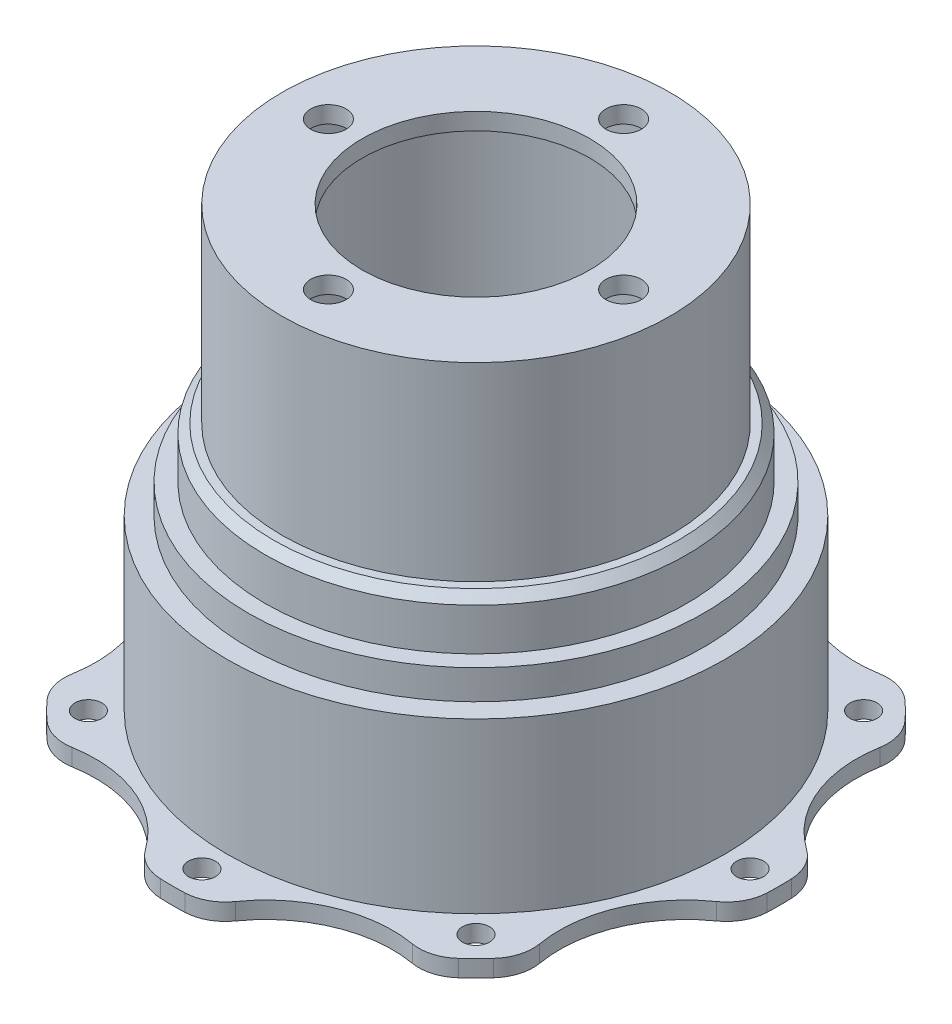
from build123d import *

# Parameters (mm, degrees)
SKETCH_1_R                       = 23
SKETCH_1_R_2                     = 13.5
EXTRUDE_1_DEPTH                  = 2
SKETCH_2_R                       = 2.1
CUT_EXTRUDE_1_DEPTH              = 3
PATTERN_CIRCULAR_1_COUNT         = 4
EXTRUDE_START                    = 32
SKETCH_3_R                       = 23
SKETCH_3_R_2                     = 21.25
EXTRUDE_2_DEPTH                  = 32
SKETCH_4_R                       = 29.5
SKETCH_4_R_2                     = 21.5
EXTRUDE_3_DEPTH                  = 2
EXTRUDE_START_2                  = 20
SKETCH_5_R                       = 29.5
SKETCH_5_R_2                     = 27.5
EXTRUDE_4_DEPTH                  = 20
SKETCH_6_R                       = 36
SKETCH_6_R_2                     = 29
EXTRUDE_5_DEPTH                  = 2
SKETCH_7_R                       = 1.6
CUT_EXTRUDE_2_DEPTH              = 3
PATTERN_CIRCULAR_2_COUNT         = 8
SKETCH_8_R                       = 25
SKETCH_8_R_2                     = 23
EXTRUDE_6_DEPTH                  = 9.5
SKETCH_9_R                       = 27
SKETCH_9_R_2                     = 25
EXTRUDE_7_DEPTH                  = 3.5
CHAMFER_1_SIZE                   = 1
SKETCH_12_R                      = 15
CUT_EXTRUDE_4_DEPTH              = 10
FILLET_2_R                       = 5
PATTERN_CIRCULAR_4_COUNT         = 8
FILLET_2_OF_PATTERN_CIRCULAR_4_R = 5


with BuildPart() as part:
    # 草图1 → 凸台-拉伸1 (new body)
    with BuildSketch(Plane(origin=(0, 0, 0), x_dir=(1, 0, 0), z_dir=(0, 1, 0))):
        with Locations(Location((0, 0, 0), (0, 0, 270))):
            Circle(SKETCH_1_R)
        with Locations(Location((0, 0, 0), (0, 0, 270))):
            Circle(SKETCH_1_R_2, mode=Mode.SUBTRACT)
    extrude(amount=EXTRUDE_1_DEPTH)

    # 草图2 → 切除-拉伸1 (cut)
    with BuildSketch(Plane(origin=(0, 2, 0), x_dir=(1, 0, 0), z_dir=(0, 1, 0))):
        with Locations(Location((0, 17.5, 0), (0, 0, 270))):
            Circle(SKETCH_2_R)
    cut_extrude_1 = extrude(amount=-CUT_EXTRUDE_1_DEPTH, mode=Mode.SUBTRACT)

    # 阵列(圆周)1: 切除-拉伸1 ×4 about axis
    pattern_circular_1_axis = Axis((0, 0, 0), (0, 1, 0))
    for i in range(1, PATTERN_CIRCULAR_1_COUNT):
        add(cut_extrude_1.rotate(pattern_circular_1_axis, i * 360 / PATTERN_CIRCULAR_1_COUNT), mode=Mode.SUBTRACT)

    # 草图3 → 凸台-拉伸2 (add)
    with BuildSketch(Plane.XZ.offset(EXTRUDE_START)):
        with Locations(Location((0, 0, 0), (0, 0, 270))):
            Circle(SKETCH_3_R)
        with Locations(Location((0, 0, 0), (0, 0, 270))):
            Circle(SKETCH_3_R_2, mode=Mode.SUBTRACT)
    extrude(amount=-EXTRUDE_2_DEPTH)

    # 草图4 → 凸台-拉伸3 (add)
    with BuildSketch(Plane.XZ.offset(32)):
        with Locations(Location((0, 0, 0), (0, 0, 270))):
            Circle(SKETCH_4_R)
        Circle(SKETCH_4_R_2, mode=Mode.SUBTRACT)
    extrude(amount=-EXTRUDE_3_DEPTH)

    # 草图5 → 凸台-拉伸4 (add)
    with BuildSketch(Plane.XZ.offset(32).offset(EXTRUDE_START_2)):
        with Locations(Location((0, 0, 0), (0, 0, 270))):
            Circle(SKETCH_5_R)
        with Locations(Location((0, 0, 0), (0, 0, 270))):
            Circle(SKETCH_5_R_2, mode=Mode.SUBTRACT)
    extrude(amount=-EXTRUDE_4_DEPTH)

    # 草图6 → 凸台-拉伸5 (add)
    with BuildSketch(Plane.XZ.offset(52)):
        with Locations(Location((0, 0, 0), (0, 0, 270))):
            Circle(SKETCH_6_R)
        Circle(SKETCH_6_R_2, mode=Mode.SUBTRACT)
    extrude(amount=-EXTRUDE_5_DEPTH)

    # 草图7 → 切除-拉伸2 (cut)
    with BuildSketch(Plane(origin=(0, -50, 0), x_dir=(1, 0, 0), z_dir=(0, 1, 0))):
        with Locations(Location((0, 32.5, 0), (0, 0, 270))):
            Circle(SKETCH_7_R)
    cut_extrude_2 = extrude(amount=-CUT_EXTRUDE_2_DEPTH, mode=Mode.SUBTRACT)

    # 阵列(圆周)2: 切除-拉伸2 ×8 about axis
    pattern_circular_2_axis = Axis((0, 0, 0), (0, 1, 0))
    for i in range(1, PATTERN_CIRCULAR_2_COUNT):
        add(cut_extrude_2.rotate(pattern_circular_2_axis, i * 360 / PATTERN_CIRCULAR_2_COUNT), mode=Mode.SUBTRACT)

    # 草图8 → 凸台-拉伸6 (add)
    with BuildSketch(Plane(origin=(0, -30, 0), x_dir=(1, 0, 0), z_dir=(0, 1, 0))):
        with Locations(Location((0, 0, 0), (0, 0, 90))):
            Circle(SKETCH_8_R)
        with Locations(Location((0, 0, 0), (0, 0, 270))):
            Circle(SKETCH_8_R_2, mode=Mode.SUBTRACT)
    extrude(amount=EXTRUDE_6_DEPTH)

    # 草图9 → 凸台-拉伸7 (add)
    with BuildSketch(Plane(origin=(0, -30, 0), x_dir=(1, 0, 0), z_dir=(0, 1, 0))):
        with Locations(Location((0, 0, 0), (0, 0, 90))):
            Circle(SKETCH_9_R)
        with Locations(Location((0, 0, 0), (0, 0, 270))):
            Circle(SKETCH_9_R_2, mode=Mode.SUBTRACT)
    extrude(amount=EXTRUDE_7_DEPTH)

    # 倒角1
    chamfer_1_edges = [part.edges().sort_by_distance(p)[0] for p in [
        (0, -20.5, 25),
    ]]
    chamfer(chamfer_1_edges, length=CHAMFER_1_SIZE)

    # 草图12 → 切除-拉伸4 (cut)
    with BuildSketch(Plane(origin=(0, -50, 0), x_dir=(1, 0, 0), z_dir=(0, 1, 0))):
        with Locations((17.603437889, 42.498458496)):
            Circle(SKETCH_12_R)
    cut_extrude_4 = extrude(amount=-CUT_EXTRUDE_4_DEPTH, mode=Mode.SUBTRACT)

    # 圆角2
    fillet_2_edges = [part.edges().sort_by_distance(p)[0] for p in [
        (22.307845583, -51, -28.255265446),
        (4.205460916, -51, -35.753518687),
    ]]
    fillet(fillet_2_edges, radius=FILLET_2_R)

    # 阵列(圆周)4: 切除-拉伸4 ×8 about axis
    pattern_circular_4_axis = Axis((0, 0, 0), (0, 1, 0))
    for i in range(1, PATTERN_CIRCULAR_4_COUNT):
        add(cut_extrude_4.rotate(pattern_circular_4_axis, i * 360 / PATTERN_CIRCULAR_4_COUNT), mode=Mode.SUBTRACT)

    # 圆角2 of 阵列(圆周)4
    fillet_2_of_pattern_circular_4_edges = [part.edges().sort_by_distance(p)[0] for p in [
        (-4.205460916, -51, -35.753518687),
        (-22.307845583, -51, -28.255265446),
        (-28.255265446, -51, -22.307845583),
        (-35.753518687, -51, -4.205460916),
        (-35.753518687, -51, 4.205460916),
        (-28.255265446, -51, 22.307845583),
        (-22.307845583, -51, 28.255265446),
        (-4.205460916, -51, 35.753518687),
        (4.205460916, -51, 35.753518687),
        (22.307845583, -51, 28.255265446),
        (28.255265446, -51, 22.307845583),
        (35.753518687, -51, 4.205460916),
        (35.753518687, -51, -4.205460916),
        (28.255265446, -51, -22.307845583),
    ]]
    fillet(fillet_2_of_pattern_circular_4_edges, radius=FILLET_2_OF_PATTERN_CIRCULAR_4_R)


solid = part.part
